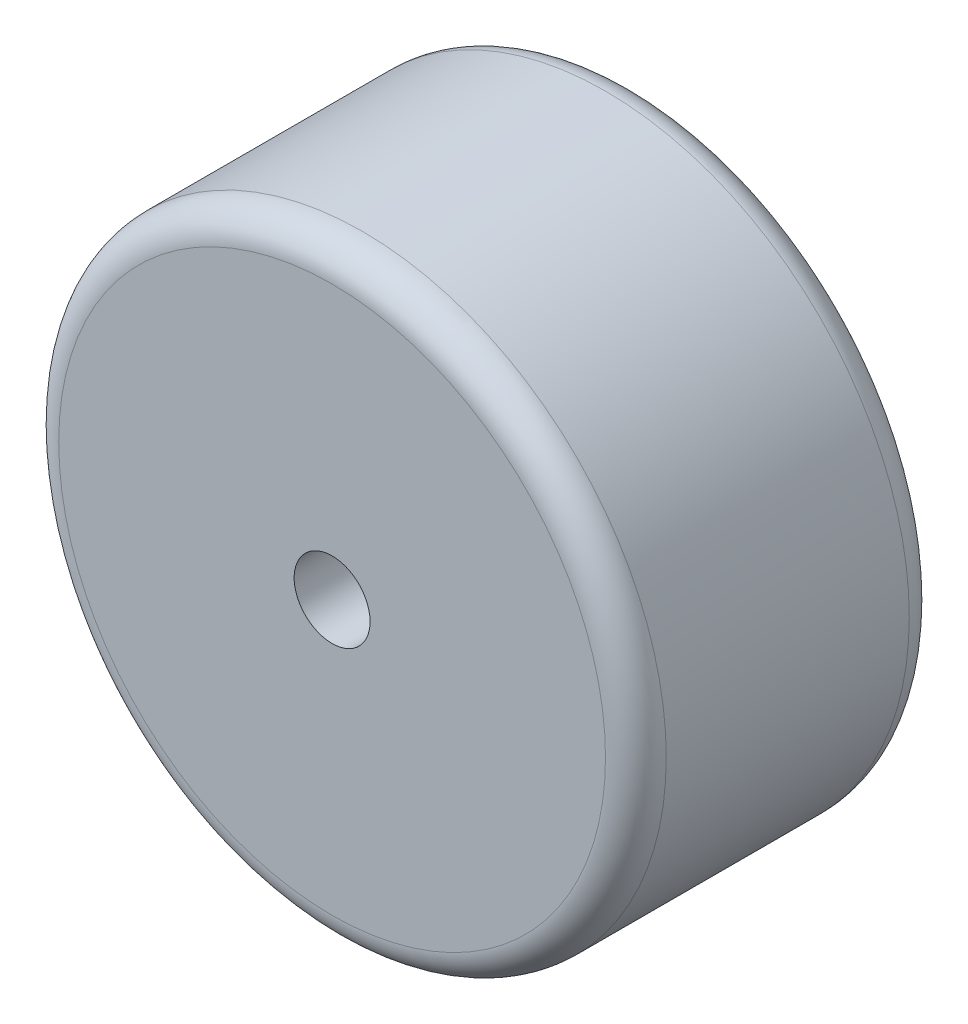
from build123d import *

# Parameters (mm, degrees)
SKETCH1_R           = 25.4
BOSS_EXTRUDE1_DEPTH = 25.4
FILLET1_R           = 2.54
CUT_EXTRUDE1_REACH  = 45.994
SKETCH2_R           = 3.175


with BuildPart() as part:
    # Sketch1 → Boss-Extrude1 (new body)
    with BuildSketch(Plane.XY):
        Circle(SKETCH1_R)
    extrude(amount=BOSS_EXTRUDE1_DEPTH)

    # Fillet1
    fillet1_edges = [part.edges().sort_by_distance(p)[0] for p in [
        (-25.4, 0, 0),
        (-25.4, 0, 25.4),
    ]]
    fillet(fillet1_edges, radius=FILLET1_R)

    # Sketch2 → Cut-Extrude1 (cut, up to next)
    with BuildSketch(Plane.XY.offset(25.4), mode=Mode.PRIVATE) as cut_extrude1_sk1:
        Circle(SKETCH2_R)
    cut_extrude1_tool1 = extrude(cut_extrude1_sk1.sketch, amount=-CUT_EXTRUDE1_REACH, mode=Mode.PRIVATE) & part.part
    add(cut_extrude1_tool1.solids().sort_by_distance((0, 0, 25.4))[0], mode=Mode.SUBTRACT)


solid = part.part
